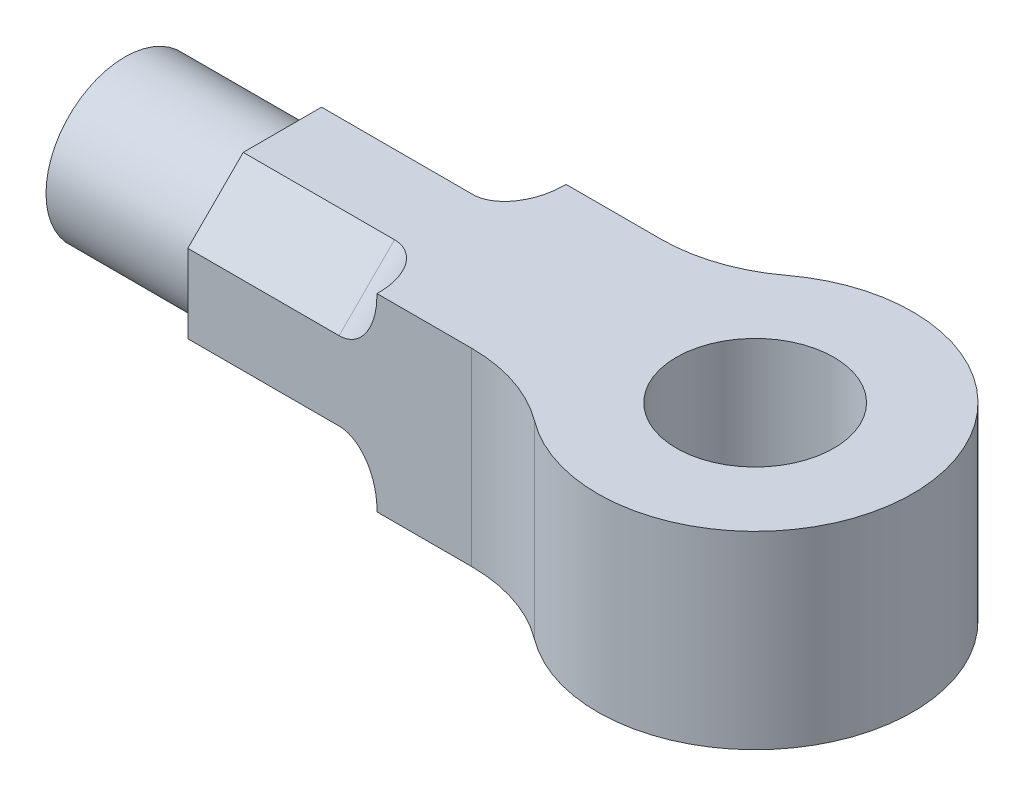
from build123d import *

# Parameters (mm, degrees)
SKETCH1_W           = 200
SKETCH1_H           = 60
BOSS_EXTRUDE1_DEPTH = 60
SKETCH2_R           = 50
SKETCH2_R_2         = 25
BOSS_EXTRUDE2_DEPTH = 60
SKETCH3_R           = 25
CUT_EXTRUDE1_DEPTH  = 60
SKETCH4_R           = 25
BOSS_EXTRUDE3_DEPTH = 50
CUT_EXTRUDE2_DEPTH  = 60
FILLET1_R           = 12
FILLET2_R           = 50


with BuildPart() as part:
    # Sketch1 → Boss-Extrude1 (new body)
    with BuildSketch(Plane.XY):
        with Locations((-100, 30)):
            Rectangle(SKETCH1_W, SKETCH1_H)
    extrude(amount=BOSS_EXTRUDE1_DEPTH)

    # Sketch2 → Boss-Extrude2 (add)
    with BuildSketch(Plane(origin=(0, 60, 0), x_dir=(1, 0, 0), z_dir=(0, 1, 0))):
        with Locations((-50, -30)):
            Circle(SKETCH2_R)
        with Locations((-50, -30)):
            Circle(SKETCH2_R_2, mode=Mode.SUBTRACT)
    extrude(amount=-BOSS_EXTRUDE2_DEPTH)

    # Sketch3 → Cut-Extrude1 (cut)
    with BuildSketch(Plane(origin=(0, 60, 0), x_dir=(1, 0, 0), z_dir=(0, 1, 0))):
        with Locations(Location((-50, -30, 0), (0, 0, 180))):
            Circle(SKETCH3_R)
        with BuildLine():
            ThreePointArc((-10, 0), (-2.565835097, -14.188611699), (0, -30))
            Line((0, -30), (0, 0))
            Line((0, 0), (-10, 0))
        make_face()
        with BuildLine():
            Line((-10, -60), (0, -60))
            Line((0, -60), (0, -30))
            ThreePointArc((0, -30), (-2.565835097, -45.811388301), (-10, -60))
        make_face()
    extrude(amount=-CUT_EXTRUDE1_DEPTH, mode=Mode.SUBTRACT)

    # Sketch4 → Boss-Extrude3 (add)
    with BuildSketch(Plane.ZY.offset(200)):
        with Locations(Location((30, 30, 0), (0, 0, 180))):
            Circle(SKETCH4_R)
    extrude(amount=BOSS_EXTRUDE3_DEPTH)

    # Sketch5 → Cut-Extrude2 (cut)
    with BuildSketch(Plane.ZY.offset(200)):
        Polygon((60, 60), (42.426406871, 60), (60, 42.426406871), align=None)
        Polygon((0, 42.426406871), (17.573593129, 60), (0, 60), align=None)
        Polygon((17.573593129, 0), (0, 17.573593129), (0, 0), align=None)
        Polygon((60, 0), (60, 17.573593129), (42.426406871, 0), align=None)
    extrude(amount=-CUT_EXTRUDE2_DEPTH, mode=Mode.SUBTRACT)

    # Fillet1
    fillet1_edges = [part.edges().sort_by_distance(p)[0] for p in [
        (-140, 8.786796564, 51.213203436),
        (-140, 51.213203436, 51.213203436),
        (-140, 51.213203436, 8.786796564),
        (-140, 8.786796564, 8.786796564),
    ]]
    fillet(fillet1_edges, radius=FILLET1_R)

    # Fillet2
    fillet2_edges = [part.edges().sort_by_distance(p)[0] for p in [
        (-90, 30, 0),
        (-90, 30, 60),
    ]]
    fillet(fillet2_edges, radius=FILLET2_R)


solid = part.part
